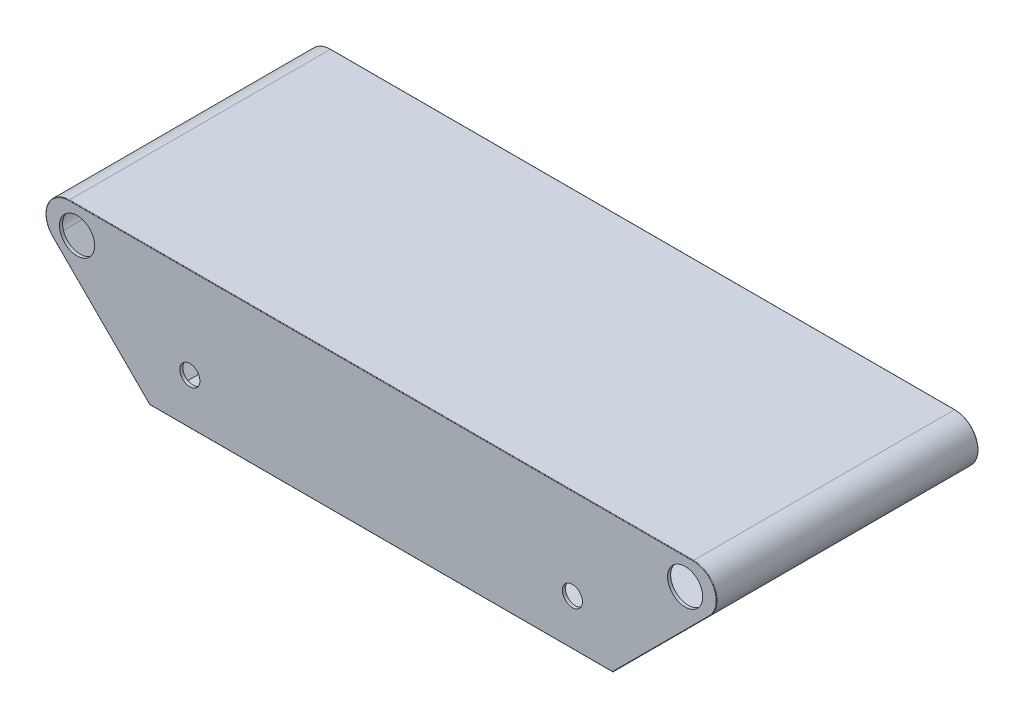
from build123d import *

# Parameters (mm, degrees)
SKETCH1_W           = 460
SKETCH1_H           = 260
BOSS_EXTRUDE1_DEPTH = 3.04
BOSS_EXTRUDE2_DEPTH = 3.04
BOSS_EXTRUDE4_DEPTH = 260
FILLET1_R           = 0.5
SKETCH6_R           = 17.465
CUT_EXTRUDE1_DEPTH  = 444.976967296
SKETCH8_R           = 10
CUT_EXTRUDE2_DEPTH  = 444.976967296


with BuildPart() as part:
    # Sketch1 → Boss-Extrude1 (new body)
    with BuildSketch(Plane(origin=(0, 0, 0), x_dir=(1, 0, 0), z_dir=(0, 1, 0))):
        Rectangle(SKETCH1_W, SKETCH1_H)
    extrude(amount=BOSS_EXTRUDE1_DEPTH)

    # Sketch2 → Boss-Extrude2 (add)
    with BuildSketch(Plane.XY.offset(130)):
        with BuildLine():
            Line((-230, 0), (230, 0))
            Line((230, 0), (326.402020254, 96.402020254))
            ThreePointArc((326.402020254, 96.402020254), (331.430272212, 121.680749903), (310, 136))
            Line((310, 136), (-310, 136))
            ThreePointArc((-310, 136), (-331.430272212, 121.680749903), (-326.402020254, 96.402020254))
            Line((-326.402020254, 96.402020254), (-230, 0))
        make_face()
    boss_extrude2 = extrude(amount=-BOSS_EXTRUDE2_DEPTH)

    # Mirror1: Boss-Extrude2 across plane
    add(boss_extrude2.mirror(Plane.XY))

    # Sketch4 → Boss-Extrude4 (add)
    with BuildSketch(Plane(origin=(0, 0, -130), x_dir=(-1, 0, 0), z_dir=(0, 0, -1))):
        with BuildLine():
            Line((-326.402020254, 96.402020254), (-230, 0))
            Line((-230, 0), (230, 0))
            Line((230, 0), (326.402020254, 96.402020254))
            ThreePointArc((326.402020254, 96.402020254), (331.430272212, 121.680749903), (310, 136))
            Line((310, 136), (-310, 136))
            ThreePointArc((-310, 136), (-331.430272212, 121.680749903), (-326.402020254, 96.402020254))
        make_face()
        with BuildLine():
            Line((-324.252415639, 98.551624868), (-228.74079077, 3.04))
            Line((-228.74079077, 3.04), (228.74079077, 3.04))
            Line((228.74079077, 3.04), (324.252415639, 98.551624868))
            ThreePointArc((324.252415639, 98.551624868), (328.621678434, 120.517392268), (310, 132.96))
            Line((310, 132.96), (-310, 132.96))
            ThreePointArc((-310, 132.96), (-328.621678434, 120.517392268), (-324.252415639, 98.551624868))
        make_face(mode=Mode.SUBTRACT)
    extrude(amount=-BOSS_EXTRUDE4_DEPTH)

    # Fillet1
    fillet1_edges = [part.edges().sort_by_distance(p)[0] for p in [
        (278.201010127, 48.201010127, 130),
        (331.430272212, 121.680749903, 130),
        (0, 136, 130),
        (-331.430272212, 121.680749903, 130),
        (-278.201010127, 48.201010127, 130),
        (-278.201010127, 48.201010127, -130),
        (278.201010127, 48.201010127, -130),
        (331.430272212, 121.680749903, -130),
        (0, 136, -130),
        (-331.430272212, 121.680749903, -130),
        (0, 0, 130),
        (-230, 0, 0),
        (0, 0, -130),
        (230, 0, 0),
    ]]
    fillet(fillet1_edges, radius=FILLET1_R)

    # Sketch6 → Cut-Extrude1 (cut, through all)
    with BuildSketch(Plane(origin=(0, 0, -130), x_dir=(-1, 0, 0), z_dir=(0, 0, -1))):
        with Locations((-302.023340597, 109.5)):
            Circle(SKETCH6_R)
        with Locations((302.023340597, 109.5)):
            Circle(SKETCH6_R)
    extrude(amount=-CUT_EXTRUDE1_DEPTH, mode=Mode.SUBTRACT)

    # Sketch8 → Cut-Extrude2 (cut, through all)
    with BuildSketch(Plane.XY.offset(130)):
        with Locations((-190, 45.5)):
            Circle(SKETCH8_R)
        with Locations(Location((190, 45.5, 0), (0, 0, 180))):
            Circle(SKETCH8_R)
    extrude(amount=-CUT_EXTRUDE2_DEPTH, mode=Mode.SUBTRACT)


solid = part.part
